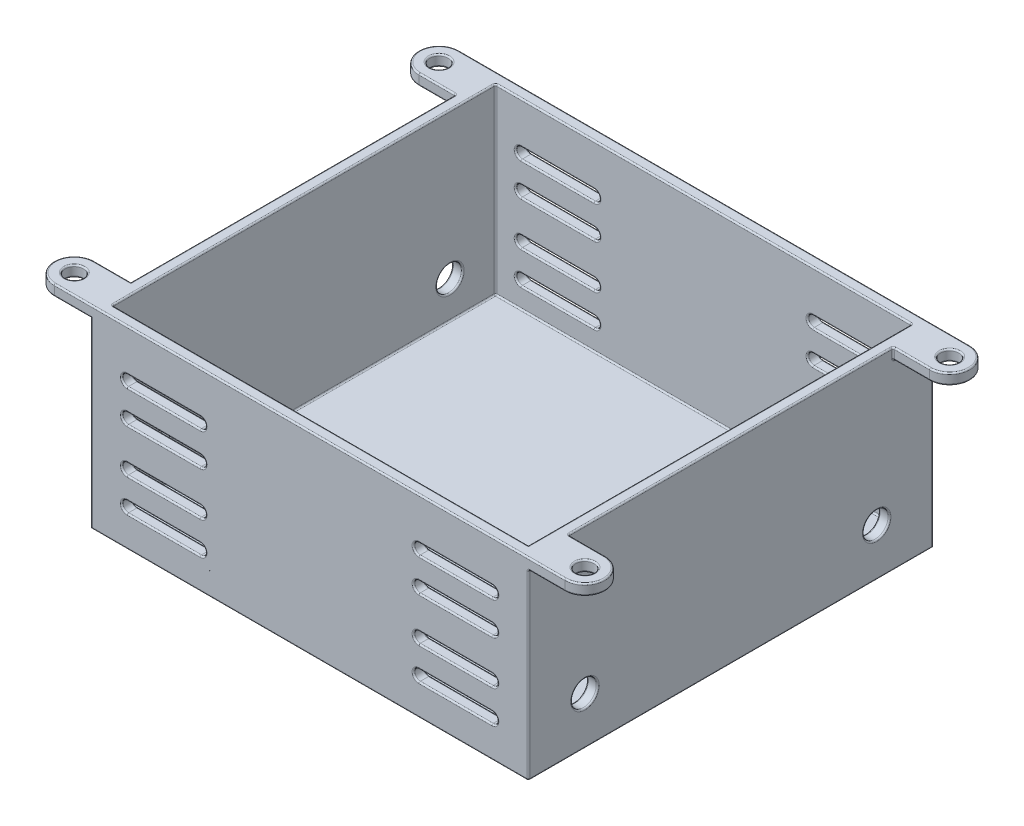
from build123d import *

# Parameters (mm, degrees)
SKETCH1_W                      = 60
SKETCH1_H                      = 55.5
SKETCH1_W_2                    = 57
SKETCH1_H_2                    = 52.5
BOSS_EXTRUDE1_DEPTH            = 25
SKETCH2_W                      = 60
SKETCH2_H                      = 55.5
BOSS_EXTRUDE2_DEPTH            = 1.5
SKETCH3_R                      = 1.25
BOSS_EXTRUDE3_DEPTH            = 1.5
CUT_EXTRUDE1_REACH             = 55.827
CUT_EXTRUDE1_DIRECTION_2_REACH = 55.827
CUT_EXTRUDE2_REACH             = 55.827
SKETCH5_R                      = 1.75
CUT_EXTRUDE2_DIRECTION_2_REACH = 55.827
FILLET1_R                      = 0.2


with BuildPart() as part:
    # Sketch1 → Boss-Extrude1 (new body)
    with BuildSketch(Plane(origin=(0, 0, 0), x_dir=(1, 0, 0), z_dir=(0, 1, 0))):
        Rectangle(SKETCH1_W, SKETCH1_H)
        Rectangle(SKETCH1_W_2, SKETCH1_H_2, mode=Mode.SUBTRACT)
    extrude(amount=-BOSS_EXTRUDE1_DEPTH)

    # Sketch2 → Boss-Extrude2 (add)
    with BuildSketch(Plane.XZ.offset(25)):
        Rectangle(SKETCH2_W, SKETCH2_H)
    extrude(amount=BOSS_EXTRUDE2_DEPTH)

    # Sketch3 → Boss-Extrude3 (add)
    # profile 1 of 4: a face of its own
    with BuildSketch(Plane(origin=(0, 0, 0), x_dir=(1, 0, 0), z_dir=(0, 1, 0))):
        with BuildLine():
            Line((30, -27.75), (30, -22.25))
            Line((30, -22.25), (35, -22.25))
            ThreePointArc((35, -22.25), (37.75, -25), (35, -27.75))
            Line((35, -27.75), (30, -27.75))
        make_face()
        with Locations(Location((35, -25, 0), (0, 0, 270))):
            Circle(SKETCH3_R, mode=Mode.SUBTRACT)
    # profile 2 of 4: a face of its own
    with BuildSketch(Plane(origin=(0, 0, 0), x_dir=(1, 0, 0), z_dir=(0, 1, 0))):
        with BuildLine():
            Line((-30, 27.75), (-30, 22.25))
            Line((-30, 22.25), (-35, 22.25))
            ThreePointArc((-35, 22.25), (-37.75, 25), (-35, 27.75))
            Line((-35, 27.75), (-30, 27.75))
        make_face()
        with Locations(Location((-35, 25, 0), (0, 0, 270))):
            Circle(SKETCH3_R, mode=Mode.SUBTRACT)
    # profile 3 of 4: a face of its own
    with BuildSketch(Plane(origin=(0, 0, 0), x_dir=(1, 0, 0), z_dir=(0, 1, 0))):
        with BuildLine():
            Line((35, 22.25), (30, 22.25))
            Line((30, 22.25), (30, 27.75))
            Line((30, 27.75), (35, 27.75))
            ThreePointArc((35, 27.75), (37.75, 25), (35, 22.25))
        make_face()
        with Locations(Location((35, 25, 0), (0, 0, 270))):
            Circle(SKETCH3_R, mode=Mode.SUBTRACT)
    # profile 4 of 4: a face of its own
    with BuildSketch(Plane(origin=(0, 0, 0), x_dir=(1, 0, 0), z_dir=(0, 1, 0))):
        with BuildLine():
            Line((-35, -22.25), (-30, -22.25))
            Line((-30, -22.25), (-30, -27.75))
            Line((-30, -27.75), (-35, -27.75))
            ThreePointArc((-35, -27.75), (-37.75, -25), (-35, -22.25))
        make_face()
        with Locations(Location((-35, -25, 0), (0, 0, 270))):
            Circle(SKETCH3_R, mode=Mode.SUBTRACT)
    extrude(amount=-BOSS_EXTRUDE3_DEPTH)

    # Cut-Extrude1: up to this face of the body (flat: up to its plane)
    cut_extrude1_end = Plane(part.part.faces().sort_by_distance((0, -13.13317757, -27.75))[0])
    # Sketch4 → Cut-Extrude1 (cut, up to the picked face)
    with BuildSketch(Plane.XY, mode=Mode.PRIVATE) as cut_extrude1_sk1:
        with BuildLine():
            Line((-25, -5.75), (-15, -5.75))
            ThreePointArc((-15, -5.75), (-14.25, -6.5), (-15, -7.25))
            Line((-15, -7.25), (-25, -7.25))
            ThreePointArc((-25, -7.25), (-25.75, -6.5), (-25, -5.75))
        make_face()
    cut_extrude1_tool1 = split(extrude(cut_extrude1_sk1.sketch, amount=-CUT_EXTRUDE1_REACH, mode=Mode.PRIVATE), bisect_by=cut_extrude1_end, keep=Keep.BOTH, mode=Mode.PRIVATE)
    # Sketch4 → Cut-Extrude1 (cut, up to the picked face)
    with BuildSketch(Plane.XY, mode=Mode.PRIVATE) as cut_extrude1_sk2:
        with BuildLine():
            Line((-25, -10.25), (-15, -10.25))
            ThreePointArc((-15, -10.25), (-14.25, -11), (-15, -11.75))
            Line((-15, -11.75), (-25, -11.75))
            ThreePointArc((-25, -11.75), (-25.75, -11), (-25, -10.25))
        make_face()
    cut_extrude1_tool2 = split(extrude(cut_extrude1_sk2.sketch, amount=-CUT_EXTRUDE1_REACH, mode=Mode.PRIVATE), bisect_by=cut_extrude1_end, keep=Keep.BOTH, mode=Mode.PRIVATE)
    # Sketch4 → Cut-Extrude1 (cut, up to the picked face)
    with BuildSketch(Plane.XY, mode=Mode.PRIVATE) as cut_extrude1_sk3:
        with BuildLine():
            Line((-25, -22.25), (-15, -22.25))
            ThreePointArc((-15, -22.25), (-14.25, -21.5), (-15, -20.75))
            Line((-15, -20.75), (-25, -20.75))
            ThreePointArc((-25, -20.75), (-25.75, -21.5), (-25, -22.25))
        make_face()
    cut_extrude1_tool3 = split(extrude(cut_extrude1_sk3.sketch, amount=-CUT_EXTRUDE1_REACH, mode=Mode.PRIVATE), bisect_by=cut_extrude1_end, keep=Keep.BOTH, mode=Mode.PRIVATE)
    # Sketch4 → Cut-Extrude1 (cut, up to the picked face)
    with BuildSketch(Plane.XY, mode=Mode.PRIVATE) as cut_extrude1_sk4:
        with BuildLine():
            Line((-25, -17.75), (-15, -17.75))
            ThreePointArc((-15, -17.75), (-14.25, -17), (-15, -16.25))
            Line((-15, -16.25), (-25, -16.25))
            ThreePointArc((-25, -16.25), (-25.75, -17), (-25, -17.75))
        make_face()
    cut_extrude1_tool4 = split(extrude(cut_extrude1_sk4.sketch, amount=-CUT_EXTRUDE1_REACH, mode=Mode.PRIVATE), bisect_by=cut_extrude1_end, keep=Keep.BOTH, mode=Mode.PRIVATE)
    # Sketch4 → Cut-Extrude1 (cut, up to the picked face)
    with BuildSketch(Plane.XY, mode=Mode.PRIVATE) as cut_extrude1_sk5:
        with BuildLine():
            Line((25, -5.75), (15, -5.75))
            ThreePointArc((15, -5.75), (14.25, -6.5), (15, -7.25))
            Line((15, -7.25), (25, -7.25))
            ThreePointArc((25, -7.25), (25.75, -6.5), (25, -5.75))
        make_face()
    cut_extrude1_tool5 = split(extrude(cut_extrude1_sk5.sketch, amount=-CUT_EXTRUDE1_REACH, mode=Mode.PRIVATE), bisect_by=cut_extrude1_end, keep=Keep.BOTH, mode=Mode.PRIVATE)
    # Sketch4 → Cut-Extrude1 (cut, up to the picked face)
    with BuildSketch(Plane.XY, mode=Mode.PRIVATE) as cut_extrude1_sk6:
        with BuildLine():
            Line((25, -10.25), (15, -10.25))
            ThreePointArc((15, -10.25), (14.25, -11), (15, -11.75))
            Line((15, -11.75), (25, -11.75))
            ThreePointArc((25, -11.75), (25.75, -11), (25, -10.25))
        make_face()
    cut_extrude1_tool6 = split(extrude(cut_extrude1_sk6.sketch, amount=-CUT_EXTRUDE1_REACH, mode=Mode.PRIVATE), bisect_by=cut_extrude1_end, keep=Keep.BOTH, mode=Mode.PRIVATE)
    # Sketch4 → Cut-Extrude1 (cut, up to the picked face)
    with BuildSketch(Plane.XY, mode=Mode.PRIVATE) as cut_extrude1_sk7:
        with BuildLine():
            Line((25, -22.25), (15, -22.25))
            ThreePointArc((15, -22.25), (14.25, -21.5), (15, -20.75))
            Line((15, -20.75), (25, -20.75))
            ThreePointArc((25, -20.75), (25.75, -21.5), (25, -22.25))
        make_face()
    cut_extrude1_tool7 = split(extrude(cut_extrude1_sk7.sketch, amount=-CUT_EXTRUDE1_REACH, mode=Mode.PRIVATE), bisect_by=cut_extrude1_end, keep=Keep.BOTH, mode=Mode.PRIVATE)
    # Sketch4 → Cut-Extrude1 (cut, up to the picked face)
    with BuildSketch(Plane.XY, mode=Mode.PRIVATE) as cut_extrude1_sk8:
        with BuildLine():
            Line((25, -17.75), (15, -17.75))
            ThreePointArc((15, -17.75), (14.25, -17), (15, -16.25))
            Line((15, -16.25), (25, -16.25))
            ThreePointArc((25, -16.25), (25.75, -17), (25, -17.75))
        make_face()
    cut_extrude1_tool8 = split(extrude(cut_extrude1_sk8.sketch, amount=-CUT_EXTRUDE1_REACH, mode=Mode.PRIVATE), bisect_by=cut_extrude1_end, keep=Keep.BOTH, mode=Mode.PRIVATE)
    add(cut_extrude1_tool1.solids().sort_by(Axis((-20, -6.5, 0), (0, 0, -1)))[0], mode=Mode.SUBTRACT)
    add(cut_extrude1_tool2.solids().sort_by(Axis((-20, -11, 0), (0, 0, -1)))[0], mode=Mode.SUBTRACT)
    add(cut_extrude1_tool3.solids().sort_by(Axis((-20, -21.5, 0), (0, 0, -1)))[0], mode=Mode.SUBTRACT)
    add(cut_extrude1_tool4.solids().sort_by(Axis((-20, -17, 0), (0, 0, -1)))[0], mode=Mode.SUBTRACT)
    add(cut_extrude1_tool5.solids().sort_by(Axis((20, -6.5, 0), (0, 0, -1)))[0], mode=Mode.SUBTRACT)
    add(cut_extrude1_tool6.solids().sort_by(Axis((20, -11, 0), (0, 0, -1)))[0], mode=Mode.SUBTRACT)
    add(cut_extrude1_tool7.solids().sort_by(Axis((20, -21.5, 0), (0, 0, -1)))[0], mode=Mode.SUBTRACT)
    add(cut_extrude1_tool8.solids().sort_by(Axis((20, -17, 0), (0, 0, -1)))[0], mode=Mode.SUBTRACT)

    # Cut-Extrude1 direction 2: up to this face of the body (flat: up to its plane)
    cut_extrude1_direction_2_end = Plane(part.part.faces().sort_by_distance((0, -13.13317757, 27.75))[0])
    # Sketch4 → Cut-Extrude1 direction 2 (cut, up to the picked face)
    with BuildSketch(Plane.XY, mode=Mode.PRIVATE) as cut_extrude1_direction_2_sk1:
        with BuildLine():
            Line((-25, -5.75), (-15, -5.75))
            ThreePointArc((-15, -5.75), (-14.25, -6.5), (-15, -7.25))
            Line((-15, -7.25), (-25, -7.25))
            ThreePointArc((-25, -7.25), (-25.75, -6.5), (-25, -5.75))
        make_face()
    cut_extrude1_direction_2_tool1 = split(extrude(cut_extrude1_direction_2_sk1.sketch, amount=CUT_EXTRUDE1_DIRECTION_2_REACH, mode=Mode.PRIVATE), bisect_by=cut_extrude1_direction_2_end, keep=Keep.BOTH, mode=Mode.PRIVATE)
    # Sketch4 → Cut-Extrude1 direction 2 (cut, up to the picked face)
    with BuildSketch(Plane.XY, mode=Mode.PRIVATE) as cut_extrude1_direction_2_sk2:
        with BuildLine():
            Line((-25, -10.25), (-15, -10.25))
            ThreePointArc((-15, -10.25), (-14.25, -11), (-15, -11.75))
            Line((-15, -11.75), (-25, -11.75))
            ThreePointArc((-25, -11.75), (-25.75, -11), (-25, -10.25))
        make_face()
    cut_extrude1_direction_2_tool2 = split(extrude(cut_extrude1_direction_2_sk2.sketch, amount=CUT_EXTRUDE1_DIRECTION_2_REACH, mode=Mode.PRIVATE), bisect_by=cut_extrude1_direction_2_end, keep=Keep.BOTH, mode=Mode.PRIVATE)
    # Sketch4 → Cut-Extrude1 direction 2 (cut, up to the picked face)
    with BuildSketch(Plane.XY, mode=Mode.PRIVATE) as cut_extrude1_direction_2_sk3:
        with BuildLine():
            Line((-25, -22.25), (-15, -22.25))
            ThreePointArc((-15, -22.25), (-14.25, -21.5), (-15, -20.75))
            Line((-15, -20.75), (-25, -20.75))
            ThreePointArc((-25, -20.75), (-25.75, -21.5), (-25, -22.25))
        make_face()
    cut_extrude1_direction_2_tool3 = split(extrude(cut_extrude1_direction_2_sk3.sketch, amount=CUT_EXTRUDE1_DIRECTION_2_REACH, mode=Mode.PRIVATE), bisect_by=cut_extrude1_direction_2_end, keep=Keep.BOTH, mode=Mode.PRIVATE)
    # Sketch4 → Cut-Extrude1 direction 2 (cut, up to the picked face)
    with BuildSketch(Plane.XY, mode=Mode.PRIVATE) as cut_extrude1_direction_2_sk4:
        with BuildLine():
            Line((-25, -17.75), (-15, -17.75))
            ThreePointArc((-15, -17.75), (-14.25, -17), (-15, -16.25))
            Line((-15, -16.25), (-25, -16.25))
            ThreePointArc((-25, -16.25), (-25.75, -17), (-25, -17.75))
        make_face()
    cut_extrude1_direction_2_tool4 = split(extrude(cut_extrude1_direction_2_sk4.sketch, amount=CUT_EXTRUDE1_DIRECTION_2_REACH, mode=Mode.PRIVATE), bisect_by=cut_extrude1_direction_2_end, keep=Keep.BOTH, mode=Mode.PRIVATE)
    # Sketch4 → Cut-Extrude1 direction 2 (cut, up to the picked face)
    with BuildSketch(Plane.XY, mode=Mode.PRIVATE) as cut_extrude1_direction_2_sk5:
        with BuildLine():
            Line((25, -5.75), (15, -5.75))
            ThreePointArc((15, -5.75), (14.25, -6.5), (15, -7.25))
            Line((15, -7.25), (25, -7.25))
            ThreePointArc((25, -7.25), (25.75, -6.5), (25, -5.75))
        make_face()
    cut_extrude1_direction_2_tool5 = split(extrude(cut_extrude1_direction_2_sk5.sketch, amount=CUT_EXTRUDE1_DIRECTION_2_REACH, mode=Mode.PRIVATE), bisect_by=cut_extrude1_direction_2_end, keep=Keep.BOTH, mode=Mode.PRIVATE)
    # Sketch4 → Cut-Extrude1 direction 2 (cut, up to the picked face)
    with BuildSketch(Plane.XY, mode=Mode.PRIVATE) as cut_extrude1_direction_2_sk6:
        with BuildLine():
            Line((25, -10.25), (15, -10.25))
            ThreePointArc((15, -10.25), (14.25, -11), (15, -11.75))
            Line((15, -11.75), (25, -11.75))
            ThreePointArc((25, -11.75), (25.75, -11), (25, -10.25))
        make_face()
    cut_extrude1_direction_2_tool6 = split(extrude(cut_extrude1_direction_2_sk6.sketch, amount=CUT_EXTRUDE1_DIRECTION_2_REACH, mode=Mode.PRIVATE), bisect_by=cut_extrude1_direction_2_end, keep=Keep.BOTH, mode=Mode.PRIVATE)
    # Sketch4 → Cut-Extrude1 direction 2 (cut, up to the picked face)
    with BuildSketch(Plane.XY, mode=Mode.PRIVATE) as cut_extrude1_direction_2_sk7:
        with BuildLine():
            Line((25, -22.25), (15, -22.25))
            ThreePointArc((15, -22.25), (14.25, -21.5), (15, -20.75))
            Line((15, -20.75), (25, -20.75))
            ThreePointArc((25, -20.75), (25.75, -21.5), (25, -22.25))
        make_face()
    cut_extrude1_direction_2_tool7 = split(extrude(cut_extrude1_direction_2_sk7.sketch, amount=CUT_EXTRUDE1_DIRECTION_2_REACH, mode=Mode.PRIVATE), bisect_by=cut_extrude1_direction_2_end, keep=Keep.BOTH, mode=Mode.PRIVATE)
    # Sketch4 → Cut-Extrude1 direction 2 (cut, up to the picked face)
    with BuildSketch(Plane.XY, mode=Mode.PRIVATE) as cut_extrude1_direction_2_sk8:
        with BuildLine():
            Line((25, -17.75), (15, -17.75))
            ThreePointArc((15, -17.75), (14.25, -17), (15, -16.25))
            Line((15, -16.25), (25, -16.25))
            ThreePointArc((25, -16.25), (25.75, -17), (25, -17.75))
        make_face()
    cut_extrude1_direction_2_tool8 = split(extrude(cut_extrude1_direction_2_sk8.sketch, amount=CUT_EXTRUDE1_DIRECTION_2_REACH, mode=Mode.PRIVATE), bisect_by=cut_extrude1_direction_2_end, keep=Keep.BOTH, mode=Mode.PRIVATE)
    add(cut_extrude1_direction_2_tool1.solids().sort_by(Axis((-20, -6.5, 0), (0, 0, 1)))[0], mode=Mode.SUBTRACT)
    add(cut_extrude1_direction_2_tool2.solids().sort_by(Axis((-20, -11, 0), (0, 0, 1)))[0], mode=Mode.SUBTRACT)
    add(cut_extrude1_direction_2_tool3.solids().sort_by(Axis((-20, -21.5, 0), (0, 0, 1)))[0], mode=Mode.SUBTRACT)
    add(cut_extrude1_direction_2_tool4.solids().sort_by(Axis((-20, -17, 0), (0, 0, 1)))[0], mode=Mode.SUBTRACT)
    add(cut_extrude1_direction_2_tool5.solids().sort_by(Axis((20, -6.5, 0), (0, 0, 1)))[0], mode=Mode.SUBTRACT)
    add(cut_extrude1_direction_2_tool6.solids().sort_by(Axis((20, -11, 0), (0, 0, 1)))[0], mode=Mode.SUBTRACT)
    add(cut_extrude1_direction_2_tool7.solids().sort_by(Axis((20, -21.5, 0), (0, 0, 1)))[0], mode=Mode.SUBTRACT)
    add(cut_extrude1_direction_2_tool8.solids().sort_by(Axis((20, -17, 0), (0, 0, 1)))[0], mode=Mode.SUBTRACT)

    # Cut-Extrude2: up to this face of the body (flat: up to its plane)
    cut_extrude2_end = Plane(part.part.faces().sort_by_distance((-30, -13.391825683, 0))[0])
    # Sketch5 → Cut-Extrude2 (cut, up to the picked face)
    with BuildSketch(Plane(origin=(0, 0, 0), x_dir=(0, 0, -1), z_dir=(1, 0, 0)), mode=Mode.PRIVATE) as cut_extrude2_sk1:
        with Locations(Location((-20, -20, 0), (0, 0, 180))):
            Circle(SKETCH5_R)
    cut_extrude2_tool1 = split(extrude(cut_extrude2_sk1.sketch, amount=-CUT_EXTRUDE2_REACH, mode=Mode.PRIVATE), bisect_by=cut_extrude2_end, keep=Keep.BOTH, mode=Mode.PRIVATE)
    # Sketch5 → Cut-Extrude2 (cut, up to the picked face)
    with BuildSketch(Plane(origin=(0, 0, 0), x_dir=(0, 0, -1), z_dir=(1, 0, 0)), mode=Mode.PRIVATE) as cut_extrude2_sk2:
        with Locations(Location((20, -20, 0), (0, 0, 180))):
            Circle(SKETCH5_R)
    cut_extrude2_tool2 = split(extrude(cut_extrude2_sk2.sketch, amount=-CUT_EXTRUDE2_REACH, mode=Mode.PRIVATE), bisect_by=cut_extrude2_end, keep=Keep.BOTH, mode=Mode.PRIVATE)
    add(cut_extrude2_tool1.solids().sort_by(Axis((0, -20, 20), (-1, 0, 0)))[0], mode=Mode.SUBTRACT)
    add(cut_extrude2_tool2.solids().sort_by(Axis((0, -20, -20), (-1, 0, 0)))[0], mode=Mode.SUBTRACT)

    # Cut-Extrude2 direction 2: up to this face of the body (flat: up to its plane)
    cut_extrude2_direction_2_end = Plane(part.part.faces().sort_by_distance((30, -13.391825683, 0))[0])
    # Sketch5 → Cut-Extrude2 direction 2 (cut, up to the picked face)
    with BuildSketch(Plane(origin=(0, 0, 0), x_dir=(0, 0, -1), z_dir=(1, 0, 0)), mode=Mode.PRIVATE) as cut_extrude2_direction_2_sk1:
        with Locations(Location((-20, -20, 0), (0, 0, 180))):
            Circle(SKETCH5_R)
    cut_extrude2_direction_2_tool1 = split(extrude(cut_extrude2_direction_2_sk1.sketch, amount=CUT_EXTRUDE2_DIRECTION_2_REACH, mode=Mode.PRIVATE), bisect_by=cut_extrude2_direction_2_end, keep=Keep.BOTH, mode=Mode.PRIVATE)
    # Sketch5 → Cut-Extrude2 direction 2 (cut, up to the picked face)
    with BuildSketch(Plane(origin=(0, 0, 0), x_dir=(0, 0, -1), z_dir=(1, 0, 0)), mode=Mode.PRIVATE) as cut_extrude2_direction_2_sk2:
        with Locations(Location((20, -20, 0), (0, 0, 180))):
            Circle(SKETCH5_R)
    cut_extrude2_direction_2_tool2 = split(extrude(cut_extrude2_direction_2_sk2.sketch, amount=CUT_EXTRUDE2_DIRECTION_2_REACH, mode=Mode.PRIVATE), bisect_by=cut_extrude2_direction_2_end, keep=Keep.BOTH, mode=Mode.PRIVATE)
    add(cut_extrude2_direction_2_tool1.solids().sort_by(Axis((0, -20, 20), (1, 0, 0)))[0], mode=Mode.SUBTRACT)
    add(cut_extrude2_direction_2_tool2.solids().sort_by(Axis((0, -20, -20), (1, 0, 0)))[0], mode=Mode.SUBTRACT)

    # Fillet1
    fillet1_edges = [part.edges().sort_by_distance(p)[0] for p in [
        (-30, -14, -27.75),
        (-30, -1.5, -25),
        (20, -16.25, -27.75),
        (20, -20.75, -27.75),
        (20, -10.25, -27.75),
        (20, -5.75, -27.75),
        (-20, -16.25, -27.75),
        (-20, -20.75, -27.75),
        (-20, -10.25, -27.75),
        (-20, -5.75, -27.75),
        (-20, -5.75, 26.25),
        (20, -10.25, 26.25),
        (20, -20.75, 26.25),
        (20, -16.25, 26.25),
        (-20, -10.25, 26.25),
        (-20, -20.75, 26.25),
        (-20, -16.25, 26.25),
        (20, -5.75, 26.25),
        (-32.5, -1.5, 22.25),
        (-32.5, -1.5, -27.75),
        (32.5, -1.5, -27.75),
        (32.5, -1.5, 22.25),
        (-30, -20, -21.75),
        (30, -20, -21.75),
        (30, -20, 18.25),
        (-30, -20, 18.25),
        (-28.5, -20, -21.75),
        (28.5, -20, -21.75),
        (-28.5, -20, 18.25),
        (28.5, -20, 18.25),
        (25.75, -17, -27.75),
        (20, -17.75, -27.75),
        (14.25, -17, -27.75),
        (14.25, -17, 27.75),
        (20, -16.25, 27.75),
        (25.75, -17, 27.75),
        (20, -17.75, 27.75),
        (25.75, -21.5, -27.75),
        (20, -22.25, -27.75),
        (14.25, -21.5, -27.75),
        (14.25, -21.5, 27.75),
        (20, -20.75, 27.75),
        (25.75, -21.5, 27.75),
        (20, -22.25, 27.75),
        (25.75, -11, -27.75),
        (20, -11.75, -27.75),
        (14.25, -11, -27.75),
        (14.25, -11, 27.75),
        (20, -10.25, 27.75),
        (25.75, -11, 27.75),
        (20, -11.75, 27.75),
        (25.75, -6.5, -27.75),
        (20, -7.25, -27.75),
        (14.25, -6.5, -27.75),
        (14.25, -6.5, 27.75),
        (20, -5.75, 27.75),
        (25.75, -6.5, 27.75),
        (20, -7.25, 27.75),
        (-25.75, -17, -27.75),
        (-14.25, -17, -27.75),
        (-20, -17.75, -27.75),
        (-14.25, -17, 27.75),
        (-20, -17.75, 27.75),
        (-25.75, -17, 27.75),
        (-20, -16.25, 27.75),
        (-25.75, -21.5, -27.75),
        (-14.25, -21.5, -27.75),
        (-20, -22.25, -27.75),
        (-14.25, -21.5, 27.75),
        (-20, -22.25, 27.75),
        (-25.75, -21.5, 27.75),
        (-20, -20.75, 27.75),
        (-25.75, -11, -27.75),
        (-14.25, -11, -27.75),
        (-20, -11.75, -27.75),
        (-14.25, -11, 27.75),
        (-20, -11.75, 27.75),
        (-25.75, -11, 27.75),
        (-20, -10.25, 27.75),
        (-20, -5.75, 27.75),
        (-25.75, -6.5, 27.75),
        (-20, -7.25, 27.75),
        (-14.25, -6.5, 27.75),
        (-20, -7.25, -27.75),
        (-14.25, -6.5, -27.75),
        (-25.75, -6.5, -27.75),
        (-25.75, -6.5, 26.25),
        (-25.75, -6.5, -26.25),
        (-20, -5.75, -26.25),
        (-14.25, -6.5, 26.25),
        (-14.25, -6.5, -26.25),
        (-20, -7.25, 26.25),
        (-20, -7.25, -26.25),
        (25.75, -11, 26.25),
        (25.75, -11, -26.25),
        (20, -11.75, 26.25),
        (20, -11.75, -26.25),
        (14.25, -11, 26.25),
        (14.25, -11, -26.25),
        (20, -10.25, -26.25),
        (25.75, -21.5, 26.25),
        (25.75, -21.5, -26.25),
        (20, -22.25, 26.25),
        (20, -22.25, -26.25),
        (14.25, -21.5, 26.25),
        (14.25, -21.5, -26.25),
        (20, -20.75, -26.25),
        (25.75, -17, 26.25),
        (25.75, -17, -26.25),
        (20, -17.75, 26.25),
        (20, -17.75, -26.25),
        (14.25, -17, 26.25),
        (14.25, -17, -26.25),
        (20, -16.25, -26.25),
        (-25.75, -11, 26.25),
        (-25.75, -11, -26.25),
        (-20, -10.25, -26.25),
        (-14.25, -11, 26.25),
        (-14.25, -11, -26.25),
        (-20, -11.75, 26.25),
        (-20, -11.75, -26.25),
        (-25.75, -21.5, 26.25),
        (-25.75, -21.5, -26.25),
        (-20, -20.75, -26.25),
        (-14.25, -21.5, 26.25),
        (-14.25, -21.5, -26.25),
        (-20, -22.25, 26.25),
        (-20, -22.25, -26.25),
        (-25.75, -17, 26.25),
        (-25.75, -17, -26.25),
        (-20, -16.25, -26.25),
        (-14.25, -17, 26.25),
        (-14.25, -17, -26.25),
        (-20, -17.75, 26.25),
        (-20, -17.75, -26.25),
        (25.75, -6.5, 26.25),
        (25.75, -6.5, -26.25),
        (20, -7.25, 26.25),
        (20, -7.25, -26.25),
        (14.25, -6.5, 26.25),
        (14.25, -6.5, -26.25),
        (20, -5.75, -26.25),
        (-32.5, -1.5, 27.75),
        (-37.75, -1.5, 25),
        (-37.75, 0, 25),
        (-32.5, 0, 22.25),
        (-35, -1.5, 23.75),
        (-35, 0, 23.75),
        (-30, -0.75, -22.25),
        (-32.5, -1.5, -22.25),
        (-37.75, -1.5, -25),
        (-32.5, 0, -22.25),
        (-37.75, 0, -25),
        (-35, -1.5, -26.25),
        (-35, 0, -26.25),
        (30, -0.75, -22.25),
        (37.75, -1.5, -25),
        (32.5, -1.5, -22.25),
        (30, -1.5, -25),
        (37.75, 0, -25),
        (32.5, 0, -22.25),
        (35, -1.5, -26.25),
        (35, 0, -26.25),
        (35, -1.5, 23.75),
        (35, 0, 23.75),
        (37.75, 0, 25),
        (37.75, -1.5, 25),
        (32.5, 0, 22.25),
        (32.5, -1.5, 27.75),
        (30, -1.5, 25),
        (30, -0.75, 22.25),
        (30, -26.5, 0),
        (0, -26.5, 27.75),
        (28.5, 0, 0),
        (28.5, -25, 0),
        (0, 0, 26.25),
        (0, -25, 26.25),
        (-28.5, 0, 0),
        (-28.5, -25, 0),
        (0, 0, -26.25),
        (0, -25, -26.25),
        (30, 0, 0),
        (0, 0, -27.75),
        (-30, 0, 0),
        (0, 0, 27.75),
        (-28.5, -12.5, 26.25),
        (-28.5, -12.5, -26.25),
        (28.5, -12.5, -26.25),
        (30, -14, -27.75),
        (-30, -14, 27.75),
        (30, -14, 27.75),
    ]]
    fillet(fillet1_edges, radius=FILLET1_R)


solid = part.part
